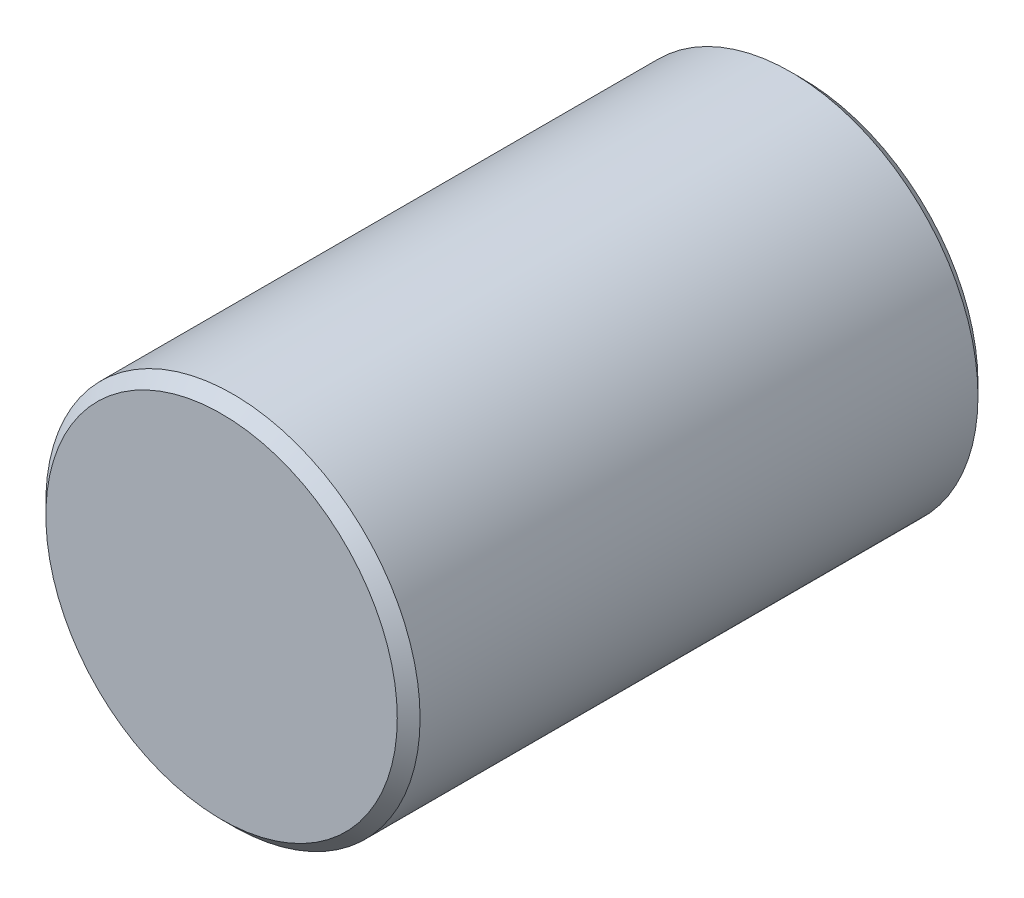
from build123d import *

# Parameters (mm, degrees)
SKETCH1_R           = 5.8
BOSS_EXTRUDE1_DEPTH = 9


with BuildPart() as part:
    # Sketch1 → Boss-Extrude1 (new, symmetric)
    with BuildSketch(Plane.XY):
        Circle(SKETCH1_R)
    extrude(amount=BOSS_EXTRUDE1_DEPTH, both=True)

    # Sketch2 → Cut-Revolve1 (revolve, cut)
    with BuildSketch(Plane(origin=(0, 0, 0), x_dir=(0, 0, -1), z_dir=(1, 0, 0)), mode=Mode.PRIVATE) as cut_revolve1_sk:
        Polygon((8.646451362, 5.8), (9, 5.446451362), (9, 5.8), align=None)
        Polygon((-9, 5.446451362), (-8.646451362, 5.8), (-9, 5.8), align=None)
    revolve(cut_revolve1_sk.sketch.rotate(Axis((0, 0, 11.101272286), (0, 0, -1)), 90), axis=Axis((0, 0, 11.101272286), (0, 0, -1)), mode=Mode.SUBTRACT)


solid = part.part
